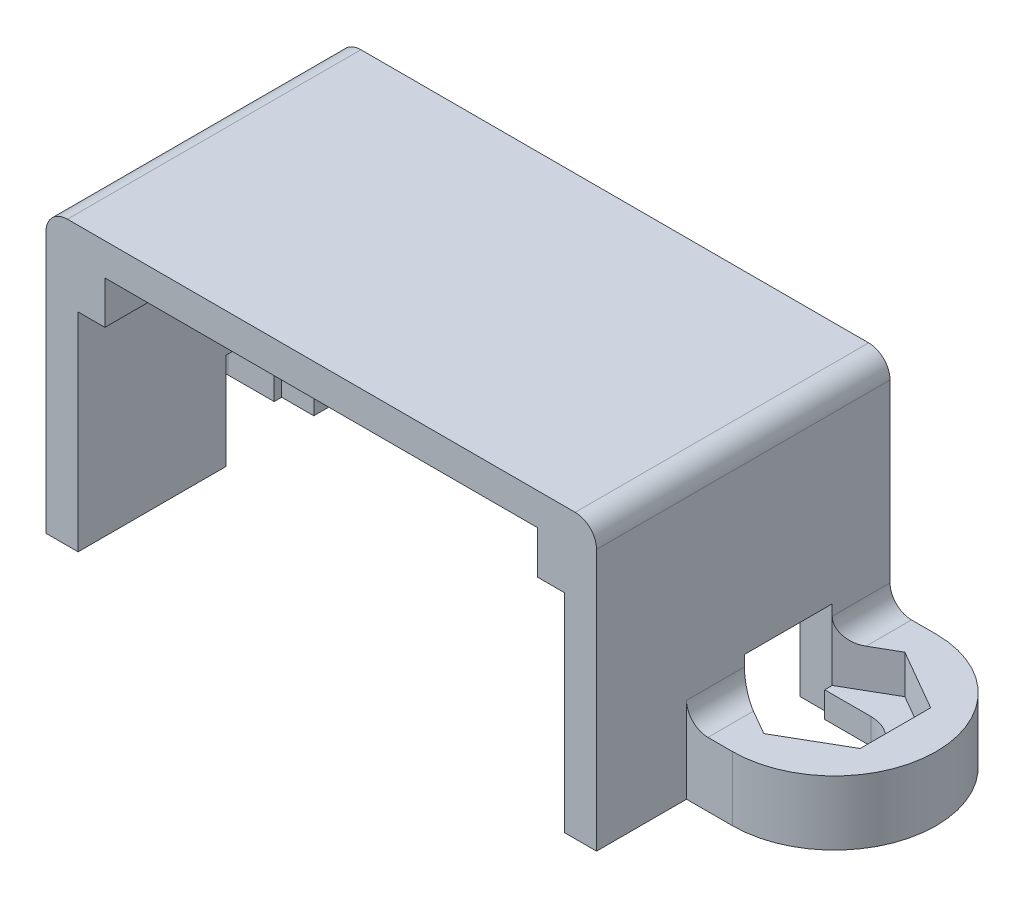
from build123d import *

# Parameters (mm, degrees)
BOSS_EXTRUDE1_DEPTH = 13.7
SKETCH3_W           = 6.9
SKETCH3_H           = 3
BOSS_EXTRUDE2_DEPTH = 9.5
SKETCH4_W           = 1.25
SKETCH4_H           = 2
BOSS_EXTRUDE3_DEPTH = 13.7
BOSS_EXTRUDE4_DEPTH = 7
CUT_EXTRUDE1_DEPTH  = 37.803396582
SKETCH7_W           = 2.15
SKETCH7_H           = 3.4
CUT_EXTRUDE2_DEPTH  = 37.803396582
CUT_EXTRUDE3_DEPTH  = 1.8
CUT_EXTRUDE4_REACH  = 38.457
SKETCH9_W           = 4.099186912
SKETCH9_H           = 4.5
FILLET1_R           = 1
FILLET2_R           = 1


with BuildPart() as part:
    # Sketch2 → Boss-Extrude1 (new body)
    with BuildSketch(Plane.XY):
        Polygon((0, 13.2), (0, 0), (1.5, 0), (1.5, 11.7), (24.2, 11.7), (24.2, 0), (25.7, 0), (25.7, 13.2), align=None)
    extrude(amount=BOSS_EXTRUDE1_DEPTH)

    # Sketch3 → Boss-Extrude2 (add)
    with BuildSketch(Plane(origin=(0, 0, 0), x_dir=(-1, 0, 0), z_dir=(0, 0, -1))):
        with Locations((-29.15, 1.5)):
            Rectangle(SKETCH3_W, SKETCH3_H)
        with Locations((3.45, 1.5)):
            Rectangle(SKETCH3_W, SKETCH3_H)
    extrude(amount=-BOSS_EXTRUDE2_DEPTH)

    # Sketch4 → Boss-Extrude3 (add)
    with BuildSketch(Plane(origin=(0, 0, 0), x_dir=(-1, 0, 0), z_dir=(0, 0, -1))):
        with Locations((-23.575, 10.7)):
            Rectangle(SKETCH4_W, SKETCH4_H)
        with Locations((-2.125, 10.7)):
            Rectangle(SKETCH4_W, SKETCH4_H)
    extrude(amount=-BOSS_EXTRUDE3_DEPTH)

    # Sketch5 → Boss-Extrude4 (add)
    with BuildSketch(Plane(origin=(0, 0, 0), x_dir=(-1, 0, 0), z_dir=(0, 0, -1))):
        Polygon((-22.95, 11.7), (-22.95, 9.7), (-22.1, 9.7), (-22.1, 10.9), (-19.8, 10.9), (-19.8, 11.7), align=None)
    extrude(amount=-BOSS_EXTRUDE4_DEPTH)

    # Sketch6 → Cut-Extrude1 (cut, through all)
    with BuildSketch(Plane(origin=(0, 3, 0), x_dir=(1, 0, 0), z_dir=(0, 1, 0))):
        with BuildLine():
            Line((32.6, -9.5), (32.6, -4.75))
            ThreePointArc((32.6, -4.75), (31.208757211, -8.108757211), (27.85, -9.5))
            Line((27.85, -9.5), (32.6, -9.5))
        make_face()
        with BuildLine():
            Line((32.6, -4.75), (32.6, 0))
            Line((32.6, 0), (27.85, 0))
            ThreePointArc((27.85, 0), (31.208757211, -1.391242789), (32.6, -4.75))
        make_face()
        with BuildLine():
            Line((-2.15, 0), (-6.9, 0))
            Line((-6.9, 0), (-6.9, -4.75))
            ThreePointArc((-6.9, -4.75), (-5.508757211, -1.391242789), (-2.15, 0))
        make_face()
        with BuildLine():
            ThreePointArc((-2.15, -9.5), (-5.508757211, -8.108757211), (-6.9, -4.75))
            Line((-6.9, -4.75), (-6.9, -9.5))
            Line((-6.9, -9.5), (-2.15, -9.5))
        make_face()
    extrude(amount=-CUT_EXTRUDE1_DEPTH, mode=Mode.SUBTRACT)

    # Sketch7 → Cut-Extrude2 (cut, through all)
    with BuildSketch(Plane(origin=(0, 3, 0), x_dir=(1, 0, 0), z_dir=(0, 1, 0))):
        with Locations((-1.075, -4.75)):
            Rectangle(SKETCH7_W, SKETCH7_H)
        with BuildLine():
            Line((-2.15, -6.45), (-2.15, -3.05))
            ThreePointArc((-2.15, -3.05), (-3.85, -4.75), (-2.15, -6.45))
        make_face()
    cut_extrude2 = extrude(amount=-CUT_EXTRUDE2_DEPTH, mode=Mode.SUBTRACT)

    # Sketch8 → Cut-Extrude3 (cut)
    with BuildSketch(Plane(origin=(0, 3, 0), x_dir=(1, 0, 0), z_dir=(0, 1, 0))):
        Polygon((-2.15, -8.040896534), (0.7, -6.395448267), (0.7, -3.104551733), (-2.15, -1.459103466), (-5, -3.104551733), (-5, -6.395448267), align=None)
        Polygon((30.7, -6.395448267), (27.85, -8.040896534), (25, -6.395448267), (25, -3.104551733), (27.85, -1.459103466), (30.7, -3.104551733), align=None)
    cut_extrude3 = extrude(amount=-CUT_EXTRUDE3_DEPTH, mode=Mode.SUBTRACT)

    # Cut-Extrude4: up to this face of the body (flat: up to its plane)
    cut_extrude4_end = Plane(part.part.faces().sort_by_distance((0, 7.554115794, 7.242871209))[0])
    # Sketch9 → Cut-Extrude4 (cut, up to the picked face)
    with BuildSketch(Plane(origin=(1.5, 0, 0), x_dir=(0, 0, -1), z_dir=(1, 0, 0)), mode=Mode.PRIVATE) as cut_extrude4_sk1:
        with Locations((-4.75, 2.25)):
            Rectangle(SKETCH9_W, SKETCH9_H)
    cut_extrude4_tool1 = split(extrude(cut_extrude4_sk1.sketch, amount=-CUT_EXTRUDE4_REACH, mode=Mode.PRIVATE), bisect_by=cut_extrude4_end, keep=Keep.BOTH, mode=Mode.PRIVATE)
    cut_extrude4 = cut_extrude4_tool1.solids().sort_by(Axis((1.5, 2.25, 4.75), (-1, 0, 0)))[0]
    add(cut_extrude4, mode=Mode.SUBTRACT)

    # Fillet1
    fillet1_edges = [part.edges().sort_by_distance(p)[0] for p in [
        (0, 3, 1.350203272),
        (25.7, 3, 1.350203272),
        (25.7, 3, 8.149796728),
        (0, 3, 8.149796728),
    ]]
    fillet(fillet1_edges, radius=FILLET1_R)

    # Mirror1: Cut-Extrude2, Cut-Extrude3, Cut-Extrude4 across plane
    add(cut_extrude2.mirror(Plane(origin=(12.85, 0, 0), x_dir=(0, 0, 1), z_dir=(1, 0, 0))), mode=Mode.SUBTRACT)
    add(cut_extrude3.mirror(Plane(origin=(12.85, 0, 0), x_dir=(0, 0, 1), z_dir=(1, 0, 0))), mode=Mode.SUBTRACT)
    add(cut_extrude4.mirror(Plane(origin=(12.85, 0, 0), x_dir=(0, 0, 1), z_dir=(1, 0, 0))), mode=Mode.SUBTRACT)

    # Fillet2
    fillet2_edges = [part.edges().sort_by_distance(p)[0] for p in [
        (0, 13.2, 6.85),
        (25.7, 13.2, 6.85),
    ]]
    fillet(fillet2_edges, radius=FILLET2_R)


solid = part.part
